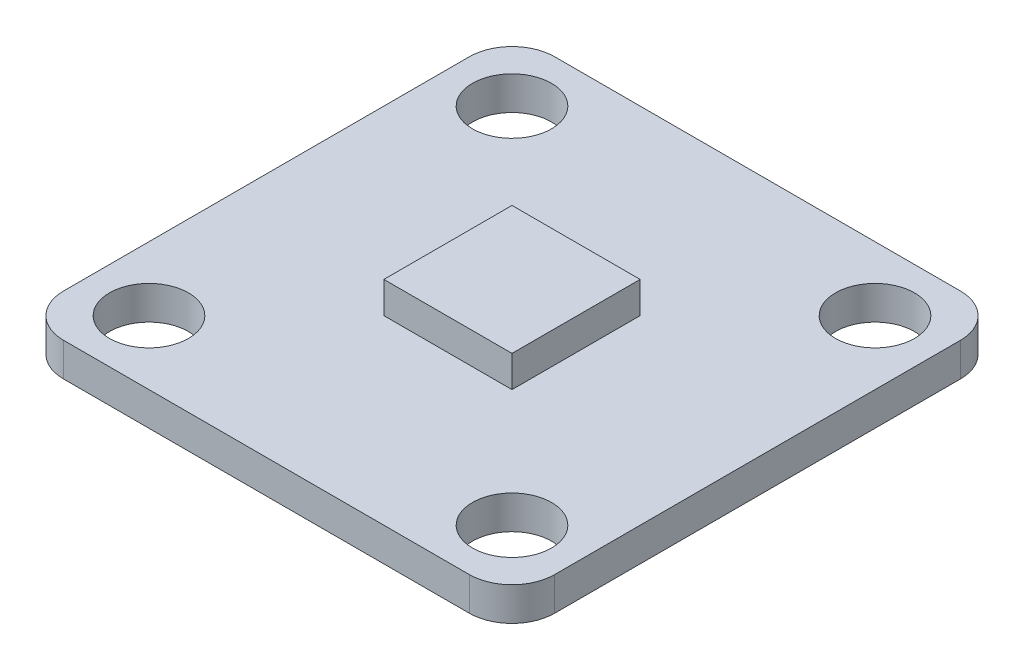
from build123d import *

# Parameters (mm, degrees)
SKETCH1_R           = 1.85
SKETCH1_W           = 6
SKETCH1_H           = 6
BOSS_EXTRUDE1_DEPTH = 1.57
SKETCH2_W           = 6
SKETCH2_H           = 6
BOSS_EXTRUDE2_DEPTH = 1.47


with BuildPart() as part:
    # Sketch1 → Boss-Extrude1 (new body)
    # profile 1 of 2: a face of its own
    with BuildSketch(Plane(origin=(0, 0, 0), x_dir=(1, 0, 0), z_dir=(0, 1, 0))):
        with BuildLine():
            ThreePointArc((-11.5, 9.5), (-10.914213562, 10.914213562), (-9.5, 11.5))
            Line((-9.5, 11.5), (9.5, 11.5))
            ThreePointArc((9.5, 11.5), (10.914213562, 10.914213562), (11.5, 9.5))
            Line((11.5, 9.5), (11.5, -9.5))
            ThreePointArc((11.5, -9.5), (10.914213562, -10.914213562), (9.5, -11.5))
            Line((9.5, -11.5), (-9.5, -11.5))
            ThreePointArc((-9.5, -11.5), (-10.914213562, -10.914213562), (-11.5, -9.5))
            Line((-11.5, -9.5), (-11.5, 9.5))
        make_face()
        with Locations(Location((-8.5, -8.5, 0), (0, 0, 270))):
            Circle(SKETCH1_R, mode=Mode.SUBTRACT)
        with Locations(Location((8.5, -8.5, 0), (0, 0, 270))):
            Circle(SKETCH1_R, mode=Mode.SUBTRACT)
        with Locations(Location((8.5, 8.5, 0), (0, 0, 270))):
            Circle(SKETCH1_R, mode=Mode.SUBTRACT)
        with Locations(Location((-8.5, 8.5, 0), (0, 0, 270))):
            Circle(SKETCH1_R, mode=Mode.SUBTRACT)
        Rectangle(SKETCH1_W, SKETCH1_H, mode=Mode.SUBTRACT)
    # profile 2 of 2: a face of its own
    with BuildSketch(Plane(origin=(0, 0, 0), x_dir=(1, 0, 0), z_dir=(0, 1, 0))):
        Rectangle(SKETCH1_W, SKETCH1_H)
    extrude(amount=BOSS_EXTRUDE1_DEPTH)

    # Sketch2 → Boss-Extrude2 (add)
    with BuildSketch(Plane(origin=(0, 1.57, 0), x_dir=(1, 0, 0), z_dir=(0, 1, 0))):
        Rectangle(SKETCH2_W, SKETCH2_H)
    extrude(amount=BOSS_EXTRUDE2_DEPTH)


solid = part.part
